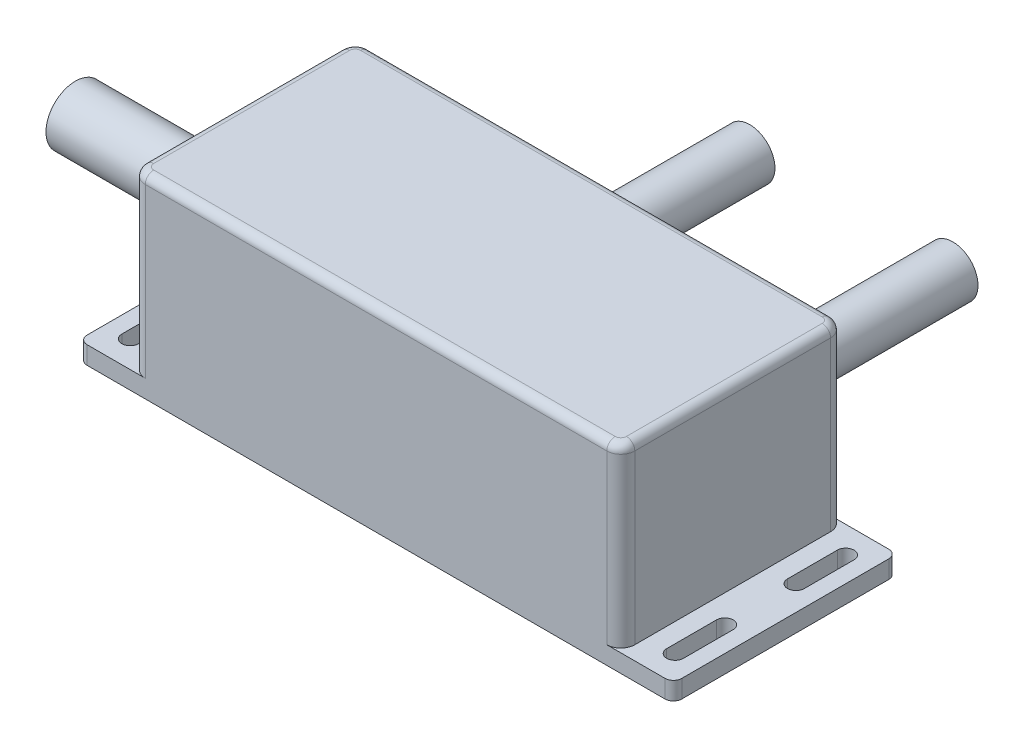
from build123d import *

# Parameters (mm, degrees)
AUFSATZ_LINEAR_AUSTRAGEN1_DEPTH = 6.4
SKIZZE2_W                       = 175
SKIZZE2_H                       = 80
AUFSATZ_LINEAR_AUSTRAGEN2_DEPTH = 63
VERRUNDUNG1_R                   = 5
VERRUNDUNG2_R                   = 3
SKIZZE3_R                       = 9
AUFSATZ_LINEAR_AUSTRAGEN3_DEPTH = 70
SKIZZE4_R                       = 10.5
AUFSATZ_LINEAR_AUSTRAGEN4_DEPTH = 60


with BuildPart() as part:
    # Skizze1 → Aufsatz-Linear austragen1 (new body)
    with BuildSketch(Plane(origin=(0, 0, 0), x_dir=(1, 0, 0), z_dir=(0, 1, 0))):
        with BuildLine():
            Line((-106.3, -37), (-106.3, 37))
            ThreePointArc((-106.3, 37), (-105.421320344, 39.121320344), (-103.3, 40))
            Line((-103.3, 40), (103.3, 40))
            ThreePointArc((103.3, 40), (105.421320344, 39.121320344), (106.3, 37))
            Line((106.3, 37), (106.3, -37))
            ThreePointArc((106.3, -37), (105.421320344, -39.121320344), (103.3, -40))
            Line((103.3, -40), (-103.3, -40))
            ThreePointArc((-103.3, -40), (-105.421320344, -39.121320344), (-106.3, -37))
        make_face()
        with BuildLine():
            Line((-94.4, 30.5), (-94.4, 12.7))
            ThreePointArc((-94.4, 12.7), (-97.4, 9.7), (-100.4, 12.7))
            Line((-100.4, 12.7), (-100.4, 30.5))
            ThreePointArc((-100.4, 30.5), (-97.4, 33.5), (-94.4, 30.5))
        make_face(mode=Mode.SUBTRACT)
        with BuildLine():
            Line((-94.4, -30.5), (-94.4, -12.7))
            ThreePointArc((-94.4, -12.7), (-97.4, -9.7), (-100.4, -12.7))
            Line((-100.4, -12.7), (-100.4, -30.5))
            ThreePointArc((-100.4, -30.5), (-97.4, -33.5), (-94.4, -30.5))
        make_face(mode=Mode.SUBTRACT)
        with BuildLine():
            Line((94.4, 30.5), (94.4, 12.7))
            ThreePointArc((94.4, 12.7), (97.4, 9.7), (100.4, 12.7))
            Line((100.4, 12.7), (100.4, 30.5))
            ThreePointArc((100.4, 30.5), (97.4, 33.5), (94.4, 30.5))
        make_face(mode=Mode.SUBTRACT)
        with BuildLine():
            Line((94.4, -30.5), (94.4, -12.7))
            ThreePointArc((94.4, -12.7), (97.4, -9.7), (100.4, -12.7))
            Line((100.4, -12.7), (100.4, -30.5))
            ThreePointArc((100.4, -30.5), (97.4, -33.5), (94.4, -30.5))
        make_face(mode=Mode.SUBTRACT)
    extrude(amount=AUFSATZ_LINEAR_AUSTRAGEN1_DEPTH)

    # Skizze2 → Aufsatz-Linear austragen2 (add)
    with BuildSketch(Plane(origin=(0, 6.4, 0), x_dir=(1, 0, 0), z_dir=(0, 1, 0))):
        Rectangle(SKIZZE2_W, SKIZZE2_H)
    extrude(amount=AUFSATZ_LINEAR_AUSTRAGEN2_DEPTH)

    # Verrundung1
    verrundung1_edges = [part.edges().sort_by_distance(p)[0] for p in [
        (-87.5, 37.9, 40),
        (87.5, 37.9, 40),
        (87.5, 37.9, -40),
        (-87.5, 37.9, -40),
    ]]
    fillet(verrundung1_edges, radius=VERRUNDUNG1_R)

    # Verrundung2
    verrundung2_edges = [part.edges().sort_by_distance(p)[0] for p in [
        (0, 69.4, 40),
        (-87.5, 69.4, 0),
        (86.035533906, 69.4, 38.535533906),
        (-86.035533906, 69.4, 38.535533906),
        (-86.035533906, 69.4, -38.535533906),
        (86.035533906, 69.4, -38.535533906),
        (0, 69.4, -40),
        (87.5, 69.4, 0),
    ]]
    fillet(verrundung2_edges, radius=VERRUNDUNG2_R)

    # Skizze3 → Aufsatz-Linear austragen3 (add)
    with BuildSketch(Plane(origin=(0, 0, -40), x_dir=(-1, 0, 0), z_dir=(0, 0, -1))):
        with Locations(Location((-56.2, 34, 0), (0, 0, 180))):
            Circle(SKIZZE3_R)
        with Locations(Location((16.4, 34, 0), (0, 0, 180))):
            Circle(SKIZZE3_R)
    extrude(amount=AUFSATZ_LINEAR_AUSTRAGEN3_DEPTH)

    # Skizze4 → Aufsatz-Linear austragen4 (add)
    with BuildSketch(Plane.ZY.offset(87.5)):
        with Locations(Location((0, 35.4, 0), (0, 0, 180))):
            Circle(SKIZZE4_R)
    extrude(amount=AUFSATZ_LINEAR_AUSTRAGEN4_DEPTH)


solid = part.part
